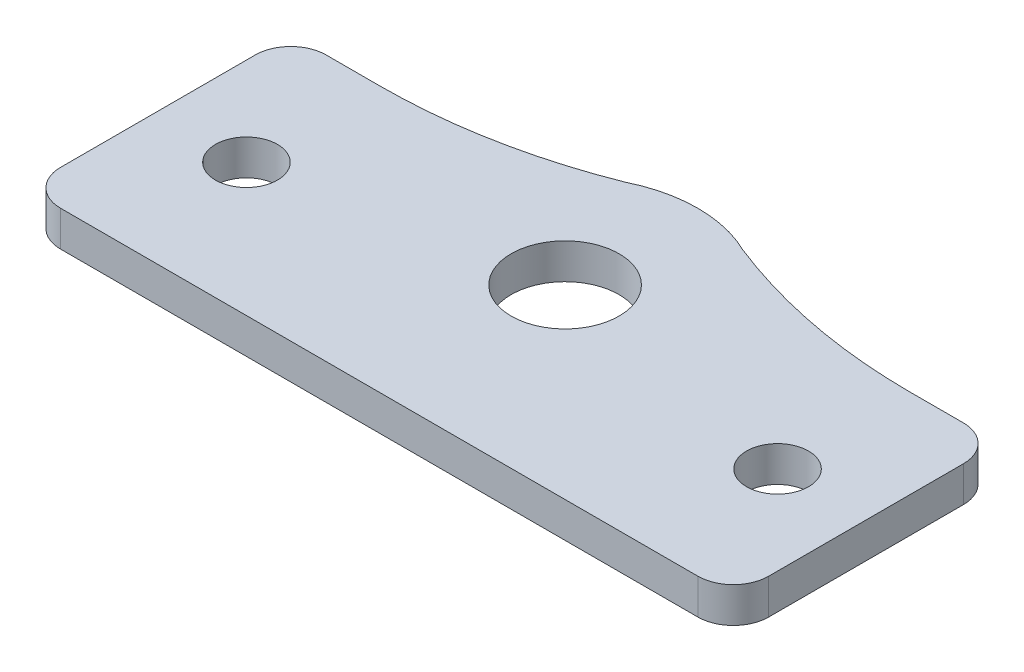
from build123d import *

# Parameters (mm, degrees)
SKETCH_1_R      = 1.75
SKETCH_1_R_2    = 3.05
EXTRUDE_1_DEPTH = 2


with BuildPart() as part:
    # 草图1 → 凸台-拉伸1 (new body)
    with BuildSketch(Plane(origin=(0, 0, 0), x_dir=(1, 0, 0), z_dir=(0, 1, 0))):
        with BuildLine():
            ThreePointArc((11.700960917, 17.23545404), (5.956293754, 15.563872091), (0, 15))
            Line((0, 15), (-3, 15))
            ThreePointArc((-3, 15), (-4.414213562, 14.414213562), (-5, 13))
            Line((-5, 13), (-5, 2))
            ThreePointArc((-5, 2), (-4.414213562, 0.585786438), (-3, 0))
            Line((-3, 0), (33, 0))
            ThreePointArc((33, 0), (34.414213562, 0.585786438), (35, 2))
            Line((35, 2), (35, 13))
            ThreePointArc((35, 13), (34.414213562, 14.414213562), (33, 15))
            Line((33, 15), (30, 15))
            ThreePointArc((30, 15), (24.043706246, 15.563872091), (18.299039083, 17.23545404))
            ThreePointArc((18.299039083, 17.23545404), (15, 18), (11.700960917, 17.23545404))
        make_face()
        with Locations(Location((30, 7.5, 0), (0, 0, 270))):
            Circle(SKETCH_1_R, mode=Mode.SUBTRACT)
        with Locations(Location((0, 7.5, 0), (0, 0, 270))):
            Circle(SKETCH_1_R, mode=Mode.SUBTRACT)
        with Locations(Location((15, 10.5, 0), (0, 0, 270))):
            Circle(SKETCH_1_R_2, mode=Mode.SUBTRACT)
    extrude(amount=EXTRUDE_1_DEPTH)


solid = part.part
